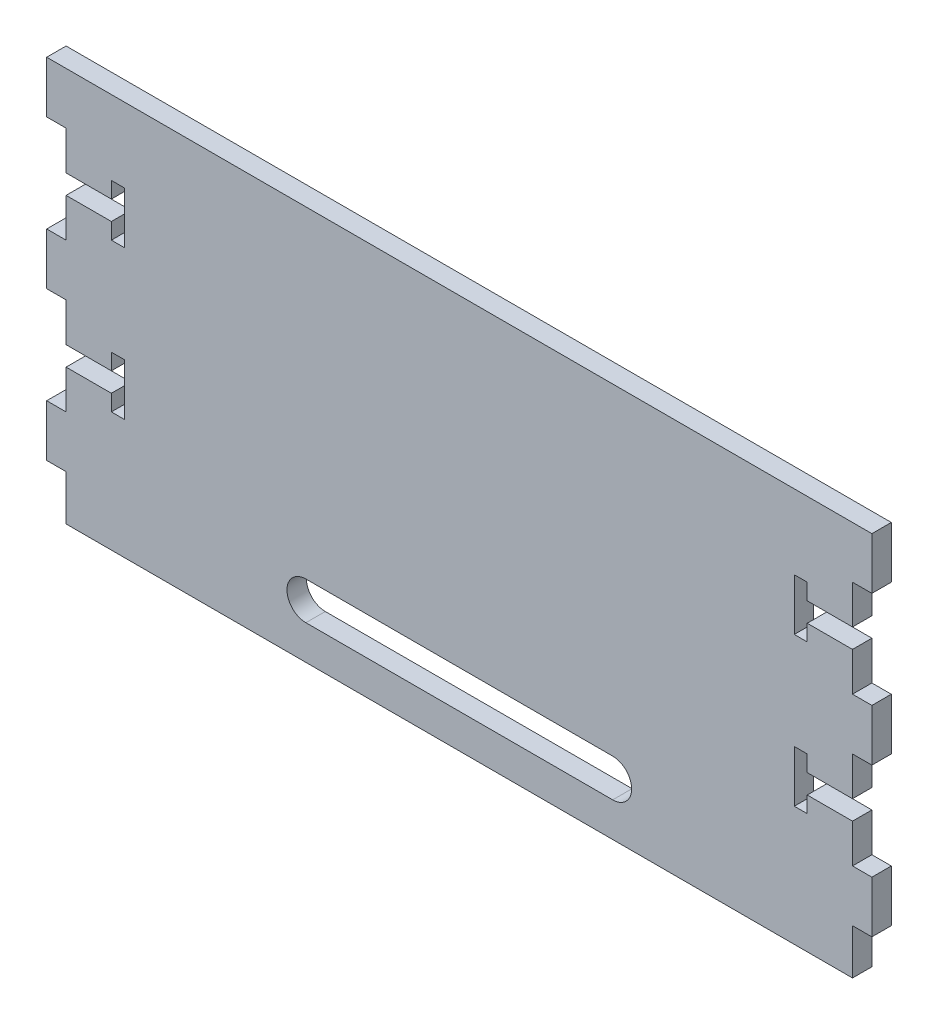
from build123d import *

# Parameters (mm, degrees)
SKETCH1_W               = 121.6
SKETCH1_H               = 61.004801574
BOSS_EXTRUDE1_DEPTH     = 3
SKETCH3_W               = 3
SKETCH3_H               = 8
BOSS_EXTRUDE2_DEPTH     = 3
SKETCH5_W               = 7
SKETCH5_H               = 3
CUT_EXTRUDE1_DEPTH      = 71.780198176
MIRROR3_COPY_1_SKETCH_W = 7
MIRROR3_COPY_1_SKETCH_H = 3
MIRROR3_COPY_1_DEPTH    = 71.780198176
VELCROHOLE_DEPTH        = 71.780198176
VELCROHOLE_DEPTH_BACK   = 71.780198176


with BuildPart() as part:
    # Sketch1 → Boss-Extrude1 (new body)
    with BuildSketch(Plane.XY):
        Rectangle(SKETCH1_W, SKETCH1_H)
    extrude(amount=BOSS_EXTRUDE1_DEPTH)

    # Sketch3 → Boss-Extrude2 (add)
    with BuildSketch(Plane(origin=(60.8, 0, 0), x_dir=(0, 0, -1), z_dir=(1, 0, 0))):
        with Locations((-1.5, 26.502400787)):
            Rectangle(SKETCH3_W, SKETCH3_H)
        with Locations((-1.5, 3.502400787)):
            Rectangle(SKETCH3_W, SKETCH3_H)
        with Locations((-1.5, -19.497599213)):
            Rectangle(SKETCH3_W, SKETCH3_H)
    boss_extrude2 = extrude(amount=BOSS_EXTRUDE2_DEPTH)

    # Mirror1: Boss-Extrude2 across plane
    add(boss_extrude2.mirror(Plane(origin=(0, 0, 0), x_dir=(0, 0, 1), z_dir=(1, 0, 0))))

    # Sketch5 → Cut-Extrude1 (cut, through all)
    with BuildSketch(Plane(origin=(0, 0, 0), x_dir=(-1, 0, 0), z_dir=(0, 0, -1))):
        with Locations((-57.3, 15.002400787)):
            Rectangle(SKETCH5_W, SKETCH5_H)
        Polygon((-53.8, 19.002400787), (-53.8, 16.502400787), (-53.8, 13.502400787), (-53.8, 11.002400787), (-51.8, 11.002400787), (-51.8, 19.002400787), align=None)
    cut_extrude1 = extrude(amount=-CUT_EXTRUDE1_DEPTH, mode=Mode.SUBTRACT)

    # Mirror2: Cut-Extrude1 across plane
    add(cut_extrude1.mirror(Plane(origin=(0, 0, 0), x_dir=(0, 0, 1), z_dir=(1, 0, 0))), mode=Mode.SUBTRACT)

    # Mirror3: Cut-Extrude1 across plane
    add(cut_extrude1.mirror(Plane(origin=(0, 3.502400787, 0), x_dir=(0, 0, 1), z_dir=(0, -1, 0))), mode=Mode.SUBTRACT)

    # Mirror3 copy 1 sketch → Mirror3 copy 1 (cut, through all)
    with BuildSketch(Plane(origin=(0, 7.004801574, 0), x_dir=(1, 0, 0), z_dir=(0, 0, -1))):
        with Locations((-57.3, 15.002400787)):
            Rectangle(MIRROR3_COPY_1_SKETCH_W, MIRROR3_COPY_1_SKETCH_H)
        Polygon((-53.8, 19.002400787), (-53.8, 16.502400787), (-53.8, 13.502400787), (-53.8, 11.002400787), (-51.8, 11.002400787), (-51.8, 19.002400787), align=None)
    extrude(amount=-MIRROR3_COPY_1_DEPTH, mode=Mode.SUBTRACT)

    # Sketch6 → VelcroHole (cut, two sides: drawn at the far end of the back side and taken through both)
    with BuildSketch(Plane(origin=(0, 0, 0), x_dir=(-1, 0, 0), z_dir=(0, 0, -1)).offset(-VELCROHOLE_DEPTH_BACK)):
        with BuildLine():
            Line((-23.721301338, -19.330337048), (23.721301338, -19.330337048))
            ThreePointArc((23.721301338, -19.330337048), (26.648610865, -22.257646575), (23.721301338, -25.184956102))
            Line((23.721301338, -25.184956102), (-23.721301338, -25.184956102))
            ThreePointArc((-23.721301338, -25.184956102), (-26.648610865, -22.257646575), (-23.721301338, -19.330337048))
        make_face()
    extrude(amount=VELCROHOLE_DEPTH + VELCROHOLE_DEPTH_BACK, mode=Mode.SUBTRACT)


solid = part.part
